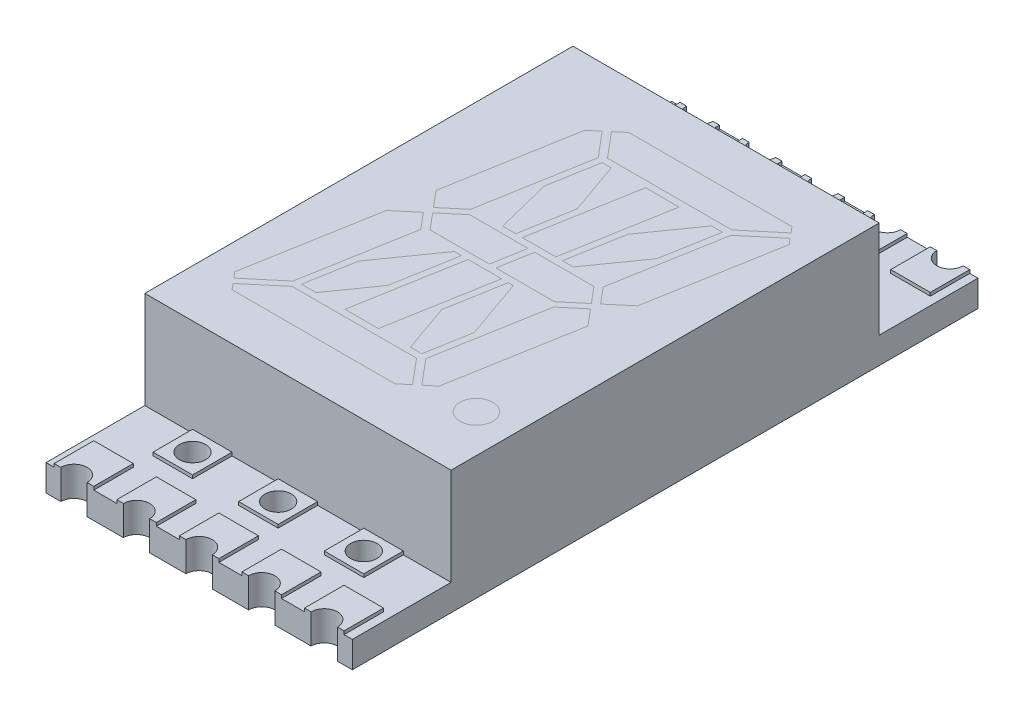
from build123d import *

# Parameters (mm, degrees)
SKETCH_1_W               = 9.3
SKETCH_1_H               = 19
EXTRUDE_1_DEPTH          = 0.8
SKETCH_2_W               = 9.3
SKETCH_2_H               = 13
EXTRUDE_2_DEPTH          = 2.95
CUT_EXTRUDE_1_DEPTH      = 0.2
CUT_EXTRUDE_2_DEPTH      = 0.2
CUT_EXTRUDE_3_DEPTH      = 0.2
SKETCH_22_R              = 0.5
CUT_EXTRUDE_4_DEPTH      = 0.2
SKETCH_24_W              = 1.2
SKETCH_24_H              = 1.2
EXTRUDE_3_DEPTH          = 0.1
CUT_EXTRUDE_5_DEPTH      = 12.74329596
CUT_EXTRUDE_5_DEPTH_BACK = 12.74329596
SKETCH_26_R              = 0.4
EXTRUDE_5_DEPTH          = 0.2
EXTRUDE_5_2_DEPTH        = 0.2
EXTRUDE_5_3_DEPTH        = 0.2
EXTRUDE_5_4_DEPTH        = 0.2
EXTRUDE_6_DEPTH          = 0.2
EXTRUDE_6_2_DEPTH        = 0.2
EXTRUDE_7_DEPTH          = 0.2
EXTRUDE_7_2_DEPTH        = 0.2
EXTRUDE_7_3_DEPTH        = 0.2
EXTRUDE_7_4_DEPTH        = 0.2
EXTRUDE_7_5_DEPTH        = 0.2
EXTRUDE_7_6_DEPTH        = 0.2
EXTRUDE_7_7_DEPTH        = 0.2
EXTRUDE_7_8_DEPTH        = 0.2
SKETCH_22_2_R            = 0.5
EXTRUDE_8_DEPTH          = 0.2


with BuildPart() as part:
    # Эскиз1 → Бобышка-Вытянуть1 (new body)
    with BuildSketch(Plane(origin=(0, 0, 0), x_dir=(1, 0, 0), z_dir=(0, 1, 0))):
        Rectangle(SKETCH_1_W, SKETCH_1_H)
    extrude(amount=EXTRUDE_1_DEPTH)

    # Эскиз2 → Бобышка-Вытянуть2 (add)
    with BuildSketch(Plane(origin=(0, 0.8, 0), x_dir=(1, 0, 0), z_dir=(0, 1, 0))):
        Rectangle(SKETCH_2_W, SKETCH_2_H)
    extrude(amount=EXTRUDE_2_DEPTH)

    # Эскиз21 → Вырез-Вытянуть1 (cut)
    with BuildSketch(Plane(origin=(0, 3.75, 0), x_dir=(1, 0, 0), z_dir=(0, 1, 0))):
        Polygon((-2.251347225, -2.40223772), (-2.511916587, -3.88), (-2.070426511, -3.88), (-1.170027732, -2.604417668), (-0.834227515, -0.7), (-1.049784045, -0.7), align=None)
        Polygon((0.587369742, -0.7), (0.740825314, -0.7), (1.382118658, -2.52740245), (1.143619216, -3.88), (0.796998801, -3.88), (0.284271691, -2.418954467), align=None)
        Polygon((2.183113044, 3.88), (2.511916587, 3.88), (2.213825111, 2.189439235), (1.162470577, 0.7), (0.834227515, 0.7), (1.132505618, 2.391619183), align=None)
        Polygon((-0.984913448, 0.7), (-0.587369742, 0.7), (-0.307494907, 2.28724906), (-0.866441612, 3.88), (-1.143619216, 3.88), (-1.405341875, 2.395697044), align=None)
    extrude(amount=-CUT_EXTRUDE_1_DEPTH, mode=Mode.SUBTRACT)

    # Эскиз17 → Вырез-Вытянуть2 (cut)
    with BuildSketch(Plane(origin=(0, 3.75, 0), x_dir=(1, 0, 0), z_dir=(0, 1, 0))):
        Polygon((-0.384284419, 0.7), (0.631142192, 0.7), (1.191861991, 3.88), (0.176435379, 3.88), align=None)
        Polygon((-0.631142192, -0.7), (-1.191861991, -3.88), (-0.176435379, -3.88), (0.384284419, -0.7), align=None)
    extrude(amount=-CUT_EXTRUDE_2_DEPTH, mode=Mode.SUBTRACT)

    # Эскиз13 → Вырез-Вытянуть3 (cut)
    with BuildSketch(Plane(origin=(0, 3.75, 0), x_dir=(1, 0, 0), z_dir=(0, 1, 0))):
        Polygon((-2.935448186, 0.628557522), (-2.258598217, 4.467164446), (-1.970028174, 4.709303462), (-1.334107302, 3.951442478), (-1.915674873, 0.653208889), (-2.526240846, 0.140883205), align=None)
        Polygon((-3.161458187, -0.653208889), (-2.550892213, -0.140883205), (-2.141684874, -0.628557522), (-2.723252444, -3.926791111), (-3.699881881, -4.746280512), (-3.851348259, -4.565769912), align=None)
        Polygon((-3.571324359, -4.8994894), (-2.594694922, -4.08), (1.180898414, -4.08), (1.816819285, -4.837860984), (1.528249243, -5.08), (-3.419857982, -5.08), align=None)
        Polygon((1.915674873, -0.653208889), (2.526240846, -0.140883205), (2.935448186, -0.628557522), (2.258598217, -4.467164446), (1.970028174, -4.709303462), (1.334107302, -3.951442478), align=None)
        Polygon((2.141684874, 0.628557522), (2.550892213, 0.140883205), (3.161458187, 0.653208889), (3.851348259, 4.565769912), (3.699881881, 4.746280512), (2.723252444, 3.926791111), align=None)
        Polygon((-1.816819285, 4.837860984), (-1.528249243, 5.08), (3.419857982, 5.08), (3.571324359, 4.8994894), (2.594694922, 4.08), (-1.180898414, 4.08), align=None)
        Polygon((-1.988475985, -0.5), (-0.189706152, -0.5), (-0.013379171, 0.5), (-1.787117351, 0.5), (-2.397683324, -0.012325683), align=None)
        Polygon((0.189706152, 0.5), (1.988475985, 0.5), (2.397683324, 0.012325683), (1.787117351, -0.5), (0.013379171, -0.5), align=None)
    extrude(amount=-CUT_EXTRUDE_3_DEPTH, mode=Mode.SUBTRACT)

    # Эскиз22 → Вырез-Вытянуть4 (cut)
    with BuildSketch(Plane(origin=(0, 3.75, 0), x_dir=(1, 0, 0), z_dir=(0, 1, 0))):
        with Locations(Location((3.5, -4.58, 0), (0, 0, 270))):
            Circle(SKETCH_22_R)
    extrude(amount=-CUT_EXTRUDE_4_DEPTH, mode=Mode.SUBTRACT)

    # Эскиз24 → Бобышка-Вытянуть3 (add)
    with BuildSketch(Plane(origin=(0, 0.8, 0), x_dir=(1, 0, 0), z_dir=(0, 1, 0))):
        with Locations((-3.8, 8.9)):
            Rectangle(SKETCH_24_W, SKETCH_24_H)
        with Locations((0, 7.1)):
            Rectangle(SKETCH_24_W, SKETCH_24_H)
        with Locations((-2.6, 7.1)):
            Rectangle(SKETCH_24_W, SKETCH_24_H)
        with Locations((2.6, 7.1)):
            Rectangle(SKETCH_24_W, SKETCH_24_H)
        with Locations((-1.9, 8.9)):
            Rectangle(SKETCH_24_W, SKETCH_24_H)
        with Locations((0, 8.9)):
            Rectangle(SKETCH_24_W, SKETCH_24_H)
        with Locations((1.9, 8.9)):
            Rectangle(SKETCH_24_W, SKETCH_24_H)
        with Locations((3.8, 8.9)):
            Rectangle(SKETCH_24_W, SKETCH_24_H)
        with Locations((3.8, -8.9)):
            Rectangle(SKETCH_24_W, SKETCH_24_H)
        with Locations((1.9, -8.9)):
            Rectangle(SKETCH_24_W, SKETCH_24_H)
        with Locations((0, -8.9)):
            Rectangle(SKETCH_24_W, SKETCH_24_H)
        with Locations((-1.9, -8.9)):
            Rectangle(SKETCH_24_W, SKETCH_24_H)
        with Locations((2.6, -7.1)):
            Rectangle(SKETCH_24_W, SKETCH_24_H)
        with Locations((-3.8, -8.9)):
            Rectangle(SKETCH_24_W, SKETCH_24_H)
        with Locations((-2.6, -7.1)):
            Rectangle(SKETCH_24_W, SKETCH_24_H)
        with Locations((0, -7.1)):
            Rectangle(SKETCH_24_W, SKETCH_24_H)
    extrude(amount=EXTRUDE_3_DEPTH)

    # Эскиз26 → Вырез-Вытянуть5 (cut, two sides: drawn at the far end of the back side and taken through both)
    with BuildSketch(Plane(origin=(0, 0.9, -0.9), x_dir=(1, 0, 0), z_dir=(0, -1, 0)).offset(-CUT_EXTRUDE_5_DEPTH_BACK)):
        with Locations(Location((-2.6, -6.2, 0), (0, 0, 270))):
            Circle(SKETCH_26_R)
        with Locations((-3.8, -8.6)):
            Circle(SKETCH_26_R)
        with Locations((-1.9, -8.6)):
            Circle(SKETCH_26_R)
        with Locations((0, -8.6)):
            Circle(SKETCH_26_R)
        with Locations((1.9, -8.6)):
            Circle(SKETCH_26_R)
        with Locations((3.8, -8.6)):
            Circle(SKETCH_26_R)
        with Locations(Location((0, -6.2, 0), (0, 0, 270))):
            Circle(SKETCH_26_R)
        with Locations(Location((2.6, -6.2, 0), (0, 0, 270))):
            Circle(SKETCH_26_R)
        with Locations(Location((2.6, 8, 0), (0, 0, 90))):
            Circle(SKETCH_26_R)
        with Locations(Location((0, 8, 0), (0, 0, 90))):
            Circle(SKETCH_26_R)
        with Locations(Location((-2.6, 8, 0), (0, 0, 90))):
            Circle(SKETCH_26_R)
        with Locations((3.8, 10.4)):
            Circle(SKETCH_26_R)
        with Locations((1.9, 10.4)):
            Circle(SKETCH_26_R)
        with Locations((0, 10.4)):
            Circle(SKETCH_26_R)
        with Locations((-1.9, 10.4)):
            Circle(SKETCH_26_R)
        with Locations((-3.8, 10.4)):
            Circle(SKETCH_26_R)
    extrude(amount=CUT_EXTRUDE_5_DEPTH + CUT_EXTRUDE_5_DEPTH_BACK, mode=Mode.SUBTRACT)


with BuildPart() as body_2:
    # Эскиз21<5> → Бобышка-Вытянуть5 (new body)
    with BuildSketch(Plane(origin=(0, 3.75, 0), x_dir=(1, 0, 0), z_dir=(0, 1, 0))):
        Polygon((-2.251347225, -2.40223772), (-2.511916587, -3.88), (-2.070426511, -3.88), (-1.170027732, -2.604417668), (-0.834227515, -0.7), (-1.049784045, -0.7), align=None)
    extrude(amount=-EXTRUDE_5_DEPTH)


with BuildPart() as body_3:
    # Эскиз21<5> → Extrude 5 2 (new body)
    with BuildSketch(Plane(origin=(0, 3.75, 0), x_dir=(1, 0, 0), z_dir=(0, 1, 0))):
        Polygon((0.587369742, -0.7), (0.740825314, -0.7), (1.382118658, -2.52740245), (1.143619216, -3.88), (0.796998801, -3.88), (0.284271691, -2.418954467), align=None)
    extrude(amount=-EXTRUDE_5_2_DEPTH)


with BuildPart() as body_4:
    # Эскиз21<5> → Extrude 5 3 (new body)
    with BuildSketch(Plane(origin=(0, 3.75, 0), x_dir=(1, 0, 0), z_dir=(0, 1, 0))):
        Polygon((2.183113044, 3.88), (2.511916587, 3.88), (2.213825111, 2.189439235), (1.162470577, 0.7), (0.834227515, 0.7), (1.132505618, 2.391619183), align=None)
    extrude(amount=-EXTRUDE_5_3_DEPTH)


with BuildPart() as body_5:
    # Эскиз21<5> → Extrude 5 4 (new body)
    with BuildSketch(Plane(origin=(0, 3.75, 0), x_dir=(1, 0, 0), z_dir=(0, 1, 0))):
        Polygon((-0.984913448, 0.7), (-0.587369742, 0.7), (-0.307494907, 2.28724906), (-0.866441612, 3.88), (-1.143619216, 3.88), (-1.405341875, 2.395697044), align=None)
    extrude(amount=-EXTRUDE_5_4_DEPTH)


with BuildPart() as body_6:
    # Эскиз17<2> → Бобышка-Вытянуть6 (new body)
    with BuildSketch(Plane(origin=(0, 3.75, 0), x_dir=(1, 0, 0), z_dir=(0, 1, 0))):
        Polygon((-0.384284419, 0.7), (0.631142192, 0.7), (1.191861991, 3.88), (0.176435379, 3.88), align=None)
    extrude(amount=-EXTRUDE_6_DEPTH)


with BuildPart() as body_7:
    # Эскиз17<2> → Extrude 6 2 (new body)
    with BuildSketch(Plane(origin=(0, 3.75, 0), x_dir=(1, 0, 0), z_dir=(0, 1, 0))):
        Polygon((-0.631142192, -0.7), (-1.191861991, -3.88), (-0.176435379, -3.88), (0.384284419, -0.7), align=None)
    extrude(amount=-EXTRUDE_6_2_DEPTH)


with BuildPart() as body_8:
    # Эскиз13<3> → Бобышка-Вытянуть7 (new body)
    with BuildSketch(Plane(origin=(0, 3.75, 0), x_dir=(1, 0, 0), z_dir=(0, 1, 0))):
        Polygon((-2.935448186, 0.628557522), (-2.258598217, 4.467164446), (-1.970028174, 4.709303462), (-1.334107302, 3.951442478), (-1.915674873, 0.653208889), (-2.526240846, 0.140883205), align=None)
    extrude(amount=-EXTRUDE_7_DEPTH)


with BuildPart() as body_9:
    # Эскиз13<3> → Extrude 7 2 (new body)
    with BuildSketch(Plane(origin=(0, 3.75, 0), x_dir=(1, 0, 0), z_dir=(0, 1, 0))):
        Polygon((-3.161458187, -0.653208889), (-2.550892213, -0.140883205), (-2.141684874, -0.628557522), (-2.723252444, -3.926791111), (-3.699881881, -4.746280512), (-3.851348259, -4.565769912), align=None)
    extrude(amount=-EXTRUDE_7_2_DEPTH)


with BuildPart() as body_10:
    # Эскиз13<3> → Extrude 7 3 (new body)
    with BuildSketch(Plane(origin=(0, 3.75, 0), x_dir=(1, 0, 0), z_dir=(0, 1, 0))):
        Polygon((-3.571324359, -4.8994894), (-2.594694922, -4.08), (1.180898414, -4.08), (1.816819285, -4.837860984), (1.528249243, -5.08), (-3.419857982, -5.08), align=None)
    extrude(amount=-EXTRUDE_7_3_DEPTH)


with BuildPart() as body_11:
    # Эскиз13<3> → Extrude 7 4 (new body)
    with BuildSketch(Plane(origin=(0, 3.75, 0), x_dir=(1, 0, 0), z_dir=(0, 1, 0))):
        Polygon((1.915674873, -0.653208889), (2.526240846, -0.140883205), (2.935448186, -0.628557522), (2.258598217, -4.467164446), (1.970028174, -4.709303462), (1.334107302, -3.951442478), align=None)
    extrude(amount=-EXTRUDE_7_4_DEPTH)


with BuildPart() as body_12:
    # Эскиз13<3> → Extrude 7 5 (new body)
    with BuildSketch(Plane(origin=(0, 3.75, 0), x_dir=(1, 0, 0), z_dir=(0, 1, 0))):
        Polygon((2.141684874, 0.628557522), (2.550892213, 0.140883205), (3.161458187, 0.653208889), (3.851348259, 4.565769912), (3.699881881, 4.746280512), (2.723252444, 3.926791111), align=None)
    extrude(amount=-EXTRUDE_7_5_DEPTH)


with BuildPart() as body_13:
    # Эскиз13<3> → Extrude 7 6 (new body)
    with BuildSketch(Plane(origin=(0, 3.75, 0), x_dir=(1, 0, 0), z_dir=(0, 1, 0))):
        Polygon((-1.816819285, 4.837860984), (-1.528249243, 5.08), (3.419857982, 5.08), (3.571324359, 4.8994894), (2.594694922, 4.08), (-1.180898414, 4.08), align=None)
    extrude(amount=-EXTRUDE_7_6_DEPTH)


with BuildPart() as body_14:
    # Эскиз13<3> → Extrude 7 7 (new body)
    with BuildSketch(Plane(origin=(0, 3.75, 0), x_dir=(1, 0, 0), z_dir=(0, 1, 0))):
        Polygon((-1.988475985, -0.5), (-0.189706152, -0.5), (-0.013379171, 0.5), (-1.787117351, 0.5), (-2.397683324, -0.012325683), align=None)
    extrude(amount=-EXTRUDE_7_7_DEPTH)


with BuildPart() as body_15:
    # Эскиз13<3> → Extrude 7 8 (new body)
    with BuildSketch(Plane(origin=(0, 3.75, 0), x_dir=(1, 0, 0), z_dir=(0, 1, 0))):
        Polygon((0.189706152, 0.5), (1.988475985, 0.5), (2.397683324, 0.012325683), (1.787117351, -0.5), (0.013379171, -0.5), align=None)
    extrude(amount=-EXTRUDE_7_8_DEPTH)


with BuildPart() as body_16:
    # Эскиз22<2> → Бобышка-Вытянуть8 (new body)
    with BuildSketch(Plane(origin=(0, 3.75, 0), x_dir=(1, 0, 0), z_dir=(0, 1, 0))):
        with Locations(Location((3.5, -4.58, 0), (0, 0, 270))):
            Circle(SKETCH_22_2_R)
    extrude(amount=-EXTRUDE_8_DEPTH)


solid = Compound([part.part, body_2.part, body_3.part, body_4.part, body_5.part, body_6.part, body_7.part, body_8.part, body_9.part, body_10.part, body_11.part, body_12.part, body_13.part, body_14.part, body_15.part, body_16.part])
